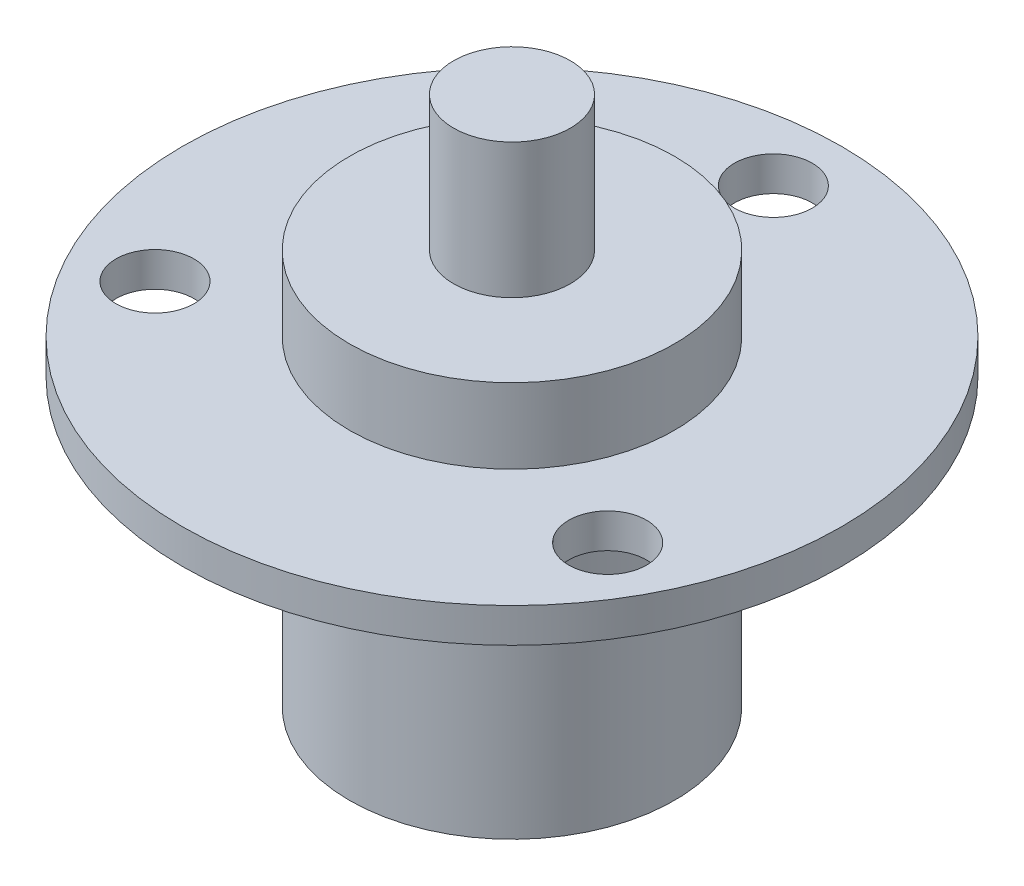
from build123d import *

# Parameters (mm, degrees)
SKETCH1_R                = 22
BOSS_EXTRUDE1_DEPTH      = 2.3
BOSS_EXTRUDE2_DEPTH      = 5
BOSS_EXTRUDE2_DEPTH_BACK = 21.4
SKETCH2_R                = 10.85
SKETCH3_R                = 3.9
BOSS_EXTRUDE3_DEPTH      = 9
SKETCH4_R                = 2.6
CUT_EXTRUDE1_DEPTH       = 38.761885546


with BuildPart() as part:
    # Sketch1 → Boss-Extrude1 (new body)
    with BuildSketch(Plane(origin=(0, 0, 0), x_dir=(1, 0, 0), z_dir=(0, 1, 0))):
        with Locations(Location((0, 0, 0), (0, 0, 270))):
            Circle(SKETCH1_R)
    extrude(amount=BOSS_EXTRUDE1_DEPTH)

    # Sketch2 → Boss-Extrude2 (add, two sides: drawn at the far end of the back side and taken through both)
    with BuildSketch(Plane(origin=(0, 2.3, 0), x_dir=(1, 0, 0), z_dir=(0, 1, 0)).offset(-BOSS_EXTRUDE2_DEPTH_BACK)):
        with Locations(Location((0, 0, 0), (0, 0, 270))):
            Circle(SKETCH2_R)
    extrude(amount=BOSS_EXTRUDE2_DEPTH + BOSS_EXTRUDE2_DEPTH_BACK)

    # Sketch3 → Boss-Extrude3 (add)
    with BuildSketch(Plane(origin=(0, 7.3, 0), x_dir=(1, 0, 0), z_dir=(0, 1, 0))):
        with Locations(Location((0, 0, 0), (0, 0, 270))):
            Circle(SKETCH3_R)
    extrude(amount=BOSS_EXTRUDE3_DEPTH)

    # Sketch4 → Cut-Extrude1 (cut, through all)
    with BuildSketch(Plane(origin=(0, 2.3, 0), x_dir=(1, 0, 0), z_dir=(0, 1, 0))):
        with Locations(Location((0, 17.45, 0), (0, 0, 270))):
            Circle(SKETCH4_R)
        with Locations(Location((-15.112143296, -8.725, 0), (0, 0, 270))):
            Circle(SKETCH4_R)
        with Locations(Location((15.112143296, -8.725, 0), (0, 0, 270))):
            Circle(SKETCH4_R)
    extrude(amount=-CUT_EXTRUDE1_DEPTH, mode=Mode.SUBTRACT)


solid = part.part
